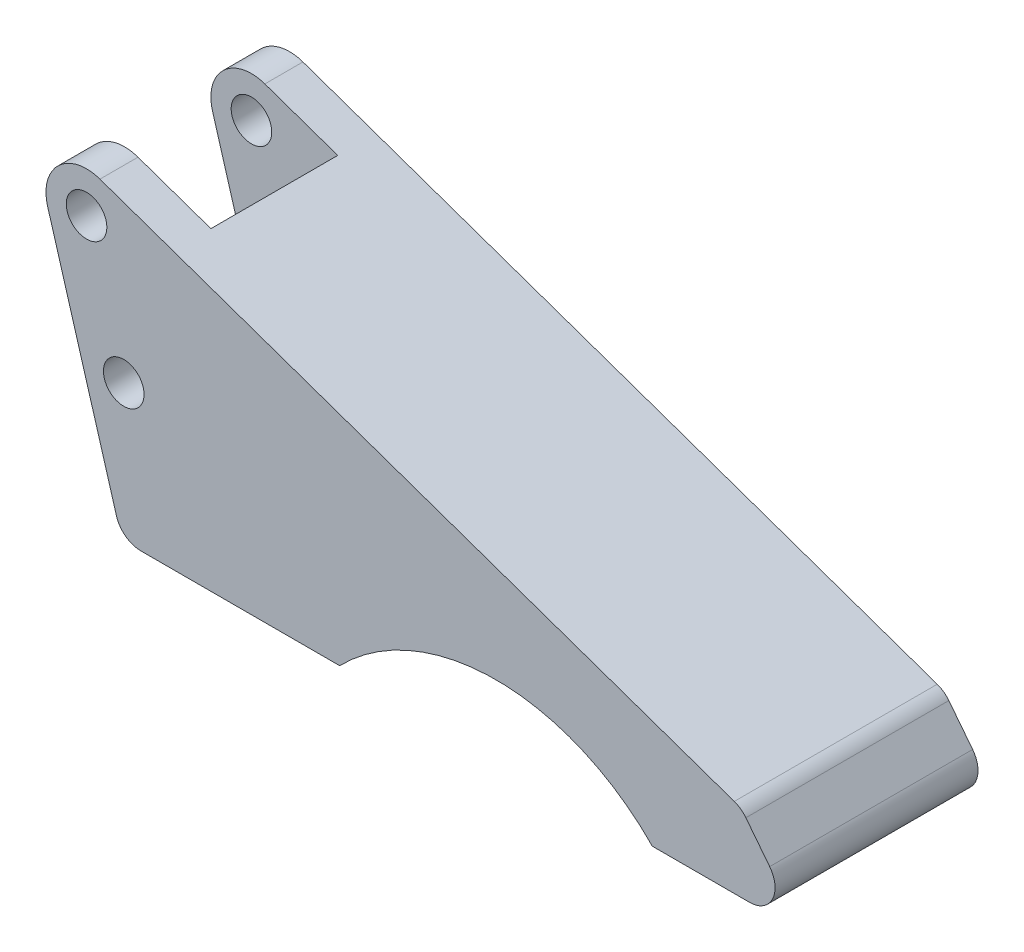
from build123d import *

# Parameters (mm, degrees)
SKETCH1_R               = 4
BOSS_EXTRUDE1_DEPTH     = 20
CUT_EXTRUDE1_DEPTH      = 138.969985504
CUT_EXTRUDE1_DEPTH_BACK = 138.969985504
SKETCH3_W               = 25
SKETCH3_H               = 25


with BuildPart() as part:
    # Sketch1 → Boss-Extrude1 (new, symmetric)
    with BuildSketch(Plane.XY):
        with BuildLine():
            Line((0, -5), (39.194156399, -5))
            ThreePointArc((39.194156399, -5), (70, 8), (100.805843601, -5))
            Line((100.805843601, -5), (120, -5))
            ThreePointArc((120, -5), (124.494057443, -2.191676915), (123.939808781, 3.07862092))
            Line((123.939808781, 3.07862092), (119.251326027, 9.07862092))
            ThreePointArc((119.251326027, 9.07862092), (118.224409903, 10.063872091), (116.961517246, 10.71990466))
            Line((116.961517246, 10.71990466), (-8.05, 54.421847456))
            ThreePointArc((-8.05, 54.421847456), (-16.204790321, 52.665436802), (-18.363488412, 44.607794087))
            Line((-18.363488412, 44.607794087), (-4.795930257, -1.413878695))
            ThreePointArc((-4.795930257, -1.413878695), (-2.994211626, -4.004334744), (0, -5))
        make_face()
        with Locations((-3.36, 22)):
            Circle(SKETCH1_R, mode=Mode.SUBTRACT)
        with Locations((-10.69, 46.87)):
            Circle(SKETCH1_R, mode=Mode.SUBTRACT)
    extrude(amount=BOSS_EXTRUDE1_DEPTH, both=True)

    # Sketch3 → Cut-Extrude1 (cut, two sides: drawn at the far end of the back side and taken through both)
    with BuildSketch(Plane(origin=(0, 0, 0), x_dir=(1, 0, 0), z_dir=(0, 1, 0)).offset(-CUT_EXTRUDE1_DEPTH_BACK)):
        with Locations((-6.19, 0)):
            Rectangle(SKETCH3_W, SKETCH3_H)
    extrude(amount=CUT_EXTRUDE1_DEPTH + CUT_EXTRUDE1_DEPTH_BACK, mode=Mode.SUBTRACT)


solid = part.part
